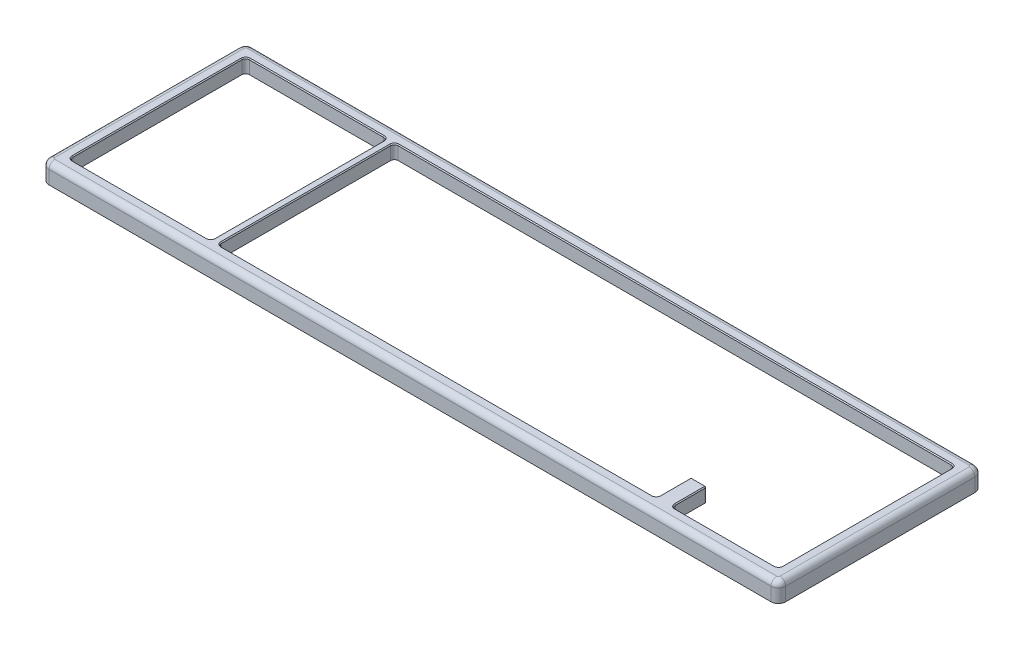
from build123d import *

# Parameters (mm, degrees)
SKETCH1_W                 = 401
SKETCH1_H                 = 111
BOSS_EXTRUDE1_DEPTH       = 10.5
CUT_EXTRUDE1_DEPTH        = 3
CUT_EXTRUDE2_DEPTH        = 417.550165046
BOSS_EXTRUDE2_DEPTH       = 7.5
FILLET4_R                 = 2
SKETCH21_W                = 4
SKETCH21_H                = 96
BOSS_EXTRUDE3_DEPTH       = 7.5
FILLET5_R                 = 2
FILLET6_R                 = 4
CHAMFER2_SIZE             = 0.5
FILLET7_R                 = 3.175
M2X0_4_TAPPED_HOLE2_D     = 1.6
M2X0_4_TAPPED_HOLE2_DEPTH = 5.75
M2X0_4_TAPPED_HOLE2_TIP   = 0.480688495
M2X0_4_TAPPED_HOLE3_D     = 1.6
M2X0_4_TAPPED_HOLE3_DEPTH = 5.75
M2X0_4_TAPPED_HOLE3_TIP   = 0.480688495
CUT_EXTRUDE3_DEPTH        = 3


with BuildPart() as part:
    # Sketch1 → Boss-Extrude1 (new body)
    with BuildSketch(Plane(origin=(0, 0, 0), x_dir=(1, 0, 0), z_dir=(0, 1, 0))):
        with Locations((200.5, 55.5)):
            Rectangle(SKETCH1_W, SKETCH1_H)
    extrude(amount=BOSS_EXTRUDE1_DEPTH)

    # Sketch2 → Cut-Extrude1 (cut)
    with BuildSketch(Plane.XZ):
        with BuildLine():
            Line((8, -2), (393, -2))
            ThreePointArc((393, -2), (397.242640687, -3.757359313), (399, -8))
            Line((399, -8), (399, -103))
            ThreePointArc((399, -103), (397.242640687, -107.242640687), (393, -109))
            Line((393, -109), (8, -109))
            ThreePointArc((8, -109), (3.757359313, -107.242640687), (2, -103))
            Line((2, -103), (2, -8))
            ThreePointArc((2, -8), (3.757359313, -3.757359313), (8, -2))
        make_face()
    extrude(amount=-CUT_EXTRUDE1_DEPTH, mode=Mode.SUBTRACT)

    # Sketch3 → Cut-Extrude2 (cut, through all)
    with BuildSketch(Plane.XZ.offset(9.3)):
        with BuildLine():
            Line((9.5, -7.5), (391.5, -7.5))
            ThreePointArc((391.5, -7.5), (392.914213562, -8.085786438), (393.5, -9.5))
            Line((393.5, -9.5), (393.5, -101.5))
            ThreePointArc((393.5, -101.5), (392.914213562, -102.914213562), (391.5, -103.5))
            Line((391.5, -103.5), (9.5, -103.5))
            ThreePointArc((9.5, -103.5), (8.085786438, -102.914213562), (7.5, -101.5))
            Line((7.5, -101.5), (7.5, -9.5))
            ThreePointArc((7.5, -9.5), (8.085786438, -8.085786438), (9.5, -7.5))
        make_face()
    extrude(amount=-CUT_EXTRUDE2_DEPTH, mode=Mode.SUBTRACT)

    # Sketch20 → Boss-Extrude2 (add)
    with BuildSketch(Plane(origin=(0, 10.5, 0), x_dir=(1, 0, 0), z_dir=(0, 1, 0))):
        with BuildLine():
            Line((327, 7.5), (335.5, 7.5))
            Line((335.5, 7.5), (335.5, 25.5))
            ThreePointArc((335.5, 25.5), (335.207106781, 26.207106781), (334.5, 26.5))
            Line((334.5, 26.5), (328, 26.5))
            ThreePointArc((328, 26.5), (327.292893219, 26.207106781), (327, 25.5))
            Line((327, 25.5), (327, 7.5))
        make_face()
    extrude(amount=-BOSS_EXTRUDE2_DEPTH)

    # Fillet4
    fillet4_edges = [part.edges().sort_by_distance(p)[0] for p in [
        (335.5, 6.75, -7.5),
        (327, 6.75, -7.5),
    ]]
    fillet(fillet4_edges, radius=FILLET4_R)

    # Sketch21 → Boss-Extrude3 (add)
    with BuildSketch(Plane(origin=(0, 10.5, 0), x_dir=(1, 0, 0), z_dir=(0, 1, 0))):
        with Locations((86.5, 55.5)):
            Rectangle(SKETCH21_W, SKETCH21_H)
    extrude(amount=-BOSS_EXTRUDE3_DEPTH)

    # Fillet5
    fillet5_edges = [part.edges().sort_by_distance(p)[0] for p in [
        (88.5, 6.75, -7.5),
        (88.5, 6.75, -103.5),
        (84.5, 6.75, -103.5),
        (84.5, 6.75, -7.5),
    ]]
    fillet(fillet5_edges, radius=FILLET5_R)

    # Fillet6
    fillet6_edges = [part.edges().sort_by_distance(p)[0] for p in [
        (0, 5.25, -111),
        (401, 5.25, -111),
        (401, 5.25, 0),
        (0, 5.25, 0),
    ]]
    fillet(fillet6_edges, radius=FILLET6_R)

    # Chamfer2
    chamfer2_edges = [part.edges().sort_by_distance(p)[0] for p in [
        (88.5, 10.5, -55.5),
        (84.5, 10.5, -55.5),
        (46, 10.5, -7.5),
        (241, 10.5, -103.5),
        (89.085786438, 10.5, -8.085786438),
        (83.914213562, 10.5, -8.085786438),
        (83.914213562, 10.5, -102.914213562),
        (89.085786438, 10.5, -102.914213562),
        (392.914213562, 10.5, -8.085786438),
        (393.5, 10.5, -55.5),
        (392.914213562, 10.5, -102.914213562),
        (46, 10.5, -103.5),
        (8.085786438, 10.5, -102.914213562),
        (7.5, 10.5, -55.5),
        (8.085786438, 10.5, -8.085786438),
        (364.5, 10.5, -7.5),
        (327, 10.5, -17.5),
        (335.207106781, 10.5, -26.207106781),
        (331.25, 10.5, -26.5),
        (327.292893219, 10.5, -26.207106781),
        (207.75, 10.5, -7.5),
        (335.5, 10.5, -17.5),
        (326.414213562, 10.5, -8.085786438),
        (336.085786438, 10.5, -8.085786438),
    ]]
    chamfer(chamfer2_edges, length=CHAMFER2_SIZE)

    # Fillet7
    fillet7_edges = [part.edges().sort_by_distance(p)[0] for p in [
        (0, 10.5, -55.5),
        (200.5, 10.5, -111),
        (200.5, 10.5, 0),
        (401, 10.5, -55.5),
        (1.171572875, 10.5, -1.171572875),
        (399.828427125, 10.5, -1.171572875),
        (399.828427125, 10.5, -109.828427125),
        (1.171572875, 10.5, -109.828427125),
    ]]
    fillet(fillet7_edges, radius=FILLET7_R)

    # M2x0.4 Tapped Hole2
    with Locations(Plane(origin=(5.375, 3, -5.375), x_dir=(0, 0, -1), z_dir=(0, -1, 0))):
        with Locations((0, 0), (0, 130), (0, 260.25), (0, 390.25), (100.25, 390.25), (100.25, 260.25), (100.25, 130), (100.25, 0)):
            Hole(M2X0_4_TAPPED_HOLE2_D / 2, depth=M2X0_4_TAPPED_HOLE2_DEPTH)
            with Locations((0, 0, -(M2X0_4_TAPPED_HOLE2_DEPTH + M2X0_4_TAPPED_HOLE2_TIP / 2))):  # 118° drill point
                Cone(0, M2X0_4_TAPPED_HOLE2_D / 2, M2X0_4_TAPPED_HOLE2_TIP, mode=Mode.SUBTRACT)

    # M2x0.4 Tapped Hole3
    with Locations(Plane(origin=(70.375, 3, -5.375), x_dir=(0, 0, -1), z_dir=(0, -1, 0))):
        with Locations((0, 0), (0, 130.125), (0, 260.25), (50.125, 325.25), (100.25, 260.25), (100.25, 130.125), (100.25, 0), (50.125, -65)):
            Hole(M2X0_4_TAPPED_HOLE3_D / 2, depth=M2X0_4_TAPPED_HOLE3_DEPTH)
            with Locations((0, 0, -(M2X0_4_TAPPED_HOLE3_DEPTH + M2X0_4_TAPPED_HOLE3_TIP / 2))):  # 118° drill point
                Cone(0, M2X0_4_TAPPED_HOLE3_D / 2, M2X0_4_TAPPED_HOLE3_TIP, mode=Mode.SUBTRACT)

    # Sketch27 → Cut-Extrude3 (cut)
    with BuildSketch(Plane.XZ):
        with BuildLine():
            Line((393, -1.75), (8, -1.75))
            ThreePointArc((8, -1.75), (3.580582618, -3.580582618), (1.75, -8))
            Line((1.75, -8), (1.75, -103))
            ThreePointArc((1.75, -103), (3.580582618, -107.419417382), (8, -109.25))
            Line((8, -109.25), (393, -109.25))
            ThreePointArc((393, -109.25), (397.419417382, -107.419417382), (399.25, -103))
            Line((399.25, -103), (399.25, -8))
            ThreePointArc((399.25, -8), (397.419417382, -3.580582618), (393, -1.75))
        make_face()
    extrude(amount=-CUT_EXTRUDE3_DEPTH, mode=Mode.SUBTRACT)


solid = part.part
